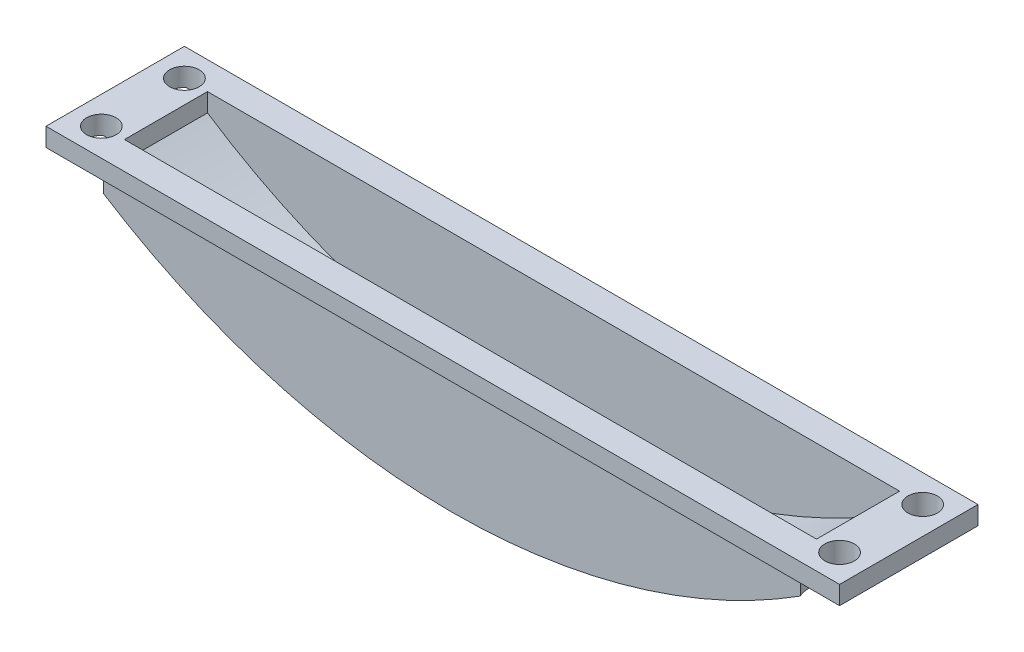
from build123d import *

# Parameters (mm, degrees)
SKETCH_3_W               = 86
SKETCH_3_H               = 15
EXTRUDE_1_DEPTH          = 2
EXTRUDE_START            = -3
EXTRUDE_2_DEPTH          = 9
EXTRUDE_START_2          = 2
EXTRUDE_3_DEPTH          = 2
CUT_EXTRUDE_1_REACH      = 87.235
CUT_EXTRUDE_1_END_RADIUS = 68.229392493
SKETCH_7_W               = 75
SKETCH_7_H               = 9
SKETCH_8_R               = 1.6
CUT_EXTRUDE_2_DEPTH      = 86.234584505
CUT_EXTRUDE_START        = -3
SKETCH_9_R               = 3
CUT_EXTRUDE_3_DEPTH      = 83.234584523


with BuildPart() as part:
    # 草图3 → 凸台-拉伸1 (new body)
    with BuildSketch(Plane(origin=(0, 0, 0), x_dir=(1, 0, 0), z_dir=(0, 1, 0))):
        with Locations((40, 4.5)):
            Rectangle(SKETCH_3_W, SKETCH_3_H)
    extrude(amount=EXTRUDE_1_DEPTH)

    # 草图5 → 凸台-拉伸2 (add)
    with BuildSketch(Plane.XY.offset(3).offset(EXTRUDE_START)):
        with BuildLine():
            Line((2.5, 0), (-1.026425264, 0))
            ThreePointArc((-1.026425264, 0), (40, -13.229392493), (81.026425264, 0))
            Line((81.026425264, 0), (77.5, 0))
            ThreePointArc((77.5, 0), (40, -11.229392493), (2.5, 0))
        make_face()
    extrude(amount=-EXTRUDE_2_DEPTH)

    # 草图6 → 凸台-拉伸3 (add)
    with BuildSketch(Plane.XY.offset(EXTRUDE_START_2)):
        with BuildLine():
            Line((-1.026425264, 0), (81.026425264, 0))
            ThreePointArc((81.026425264, 0), (40, -13.229392493), (-1.026425264, 0))
        make_face()
    extrude_3 = extrude(amount=-EXTRUDE_3_DEPTH)

    # 镜向1: 凸台-拉伸3 across plane
    add(extrude_3.mirror(Plane.XY.offset(-4.5)))

    # 切除-拉伸1: up to this cylinder (the profile starts inside it)
    cut_extrude_1_end = Plane(origin=(40, 57, -4.5), z_dir=(0, 0, 1)) * Cylinder(CUT_EXTRUDE_1_END_RADIUS, 311.928784987, mode=Mode.PRIVATE)
    # 草图7 → 切除-拉伸1 (cut, up to the surface)
    with BuildSketch(Plane(origin=(0, 2, 0), x_dir=(1, 0, 0), z_dir=(0, 1, 0)), mode=Mode.PRIVATE) as cut_extrude_1_sk1:
        with Locations((40, 4.5)):
            Rectangle(SKETCH_7_W, SKETCH_7_H)
    cut_extrude_1_tool1 = extrude(cut_extrude_1_sk1.sketch, amount=-CUT_EXTRUDE_1_REACH, mode=Mode.PRIVATE) & cut_extrude_1_end
    add(cut_extrude_1_tool1.solids().sort_by_distance((40, 2, -4.5))[0], mode=Mode.SUBTRACT)

    # 草图8 → 切除-拉伸2 (cut, through all)
    with BuildSketch(Plane(origin=(0, 2, 0), x_dir=(1, 0, 0), z_dir=(0, 1, 0))):
        with Locations(Location((80, 0, 0), (0, 0, 270))):
            Circle(SKETCH_8_R)
        with Locations(Location((80, 9, 0), (0, 0, 270))):
            Circle(SKETCH_8_R)
        with Locations(Location((0, 0, 0), (0, 0, 270))):
            Circle(SKETCH_8_R)
        with Locations(Location((0, 9, 0), (0, 0, 270))):
            Circle(SKETCH_8_R)
    extrude(amount=-CUT_EXTRUDE_2_DEPTH, mode=Mode.SUBTRACT)

    # 草图9 → 切除-拉伸3 (cut, through all)
    with BuildSketch(Plane(origin=(0, 2, 0), x_dir=(1, 0, 0), z_dir=(0, 1, 0)).offset(CUT_EXTRUDE_START)):
        with Locations((0, 9)):
            Circle(SKETCH_9_R)
        Circle(SKETCH_9_R)
        with Locations((80, 0)):
            Circle(SKETCH_9_R)
        with Locations((80, 9)):
            Circle(SKETCH_9_R)
    extrude(amount=-CUT_EXTRUDE_3_DEPTH, mode=Mode.SUBTRACT)


solid = part.part
